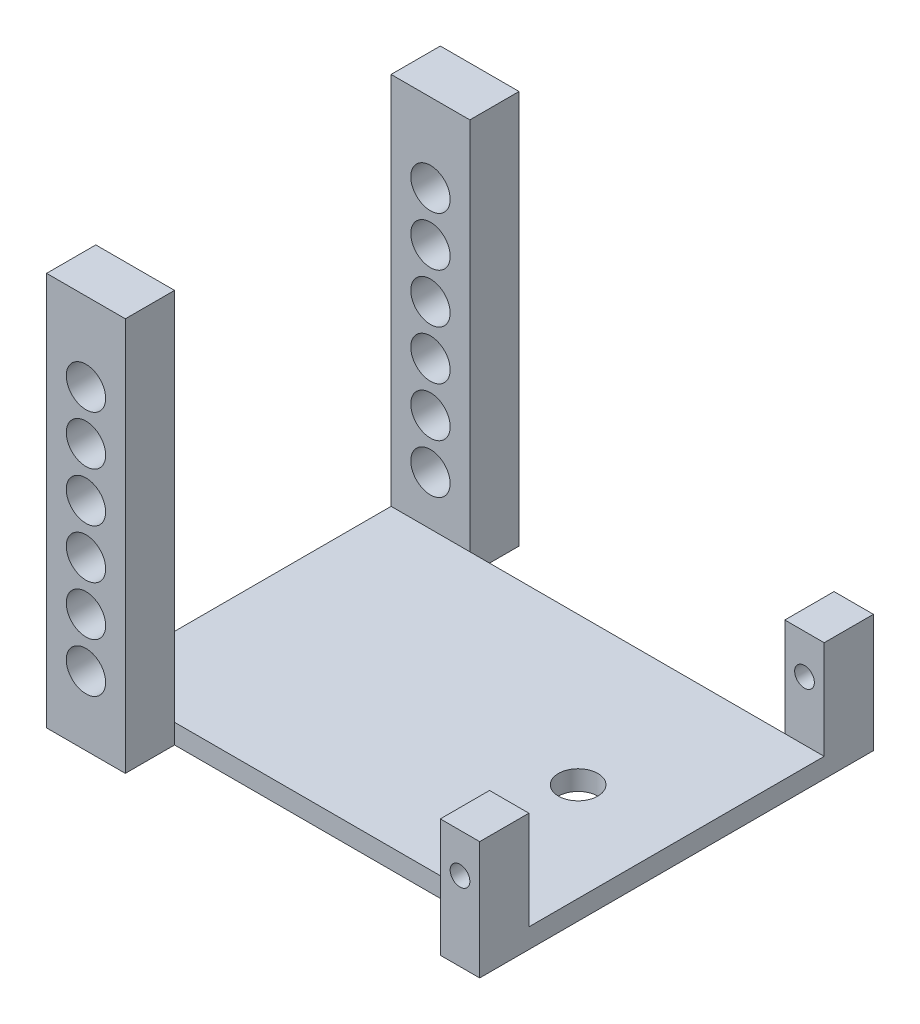
from build123d import *

# Parameters (mm, degrees)
SKETCH1_W           = 200
SKETCH1_H           = 150
BOSS_EXTRUDE1_DEPTH = 10
SKETCH2_R           = 10
CUT_EXTRUDE1_DEPTH  = 10
SKETCH4_W           = 150
SKETCH4_H           = 10
BOSS_EXTRUDE2_DEPTH = 20
SKETCH3_W           = 20
SKETCH3_H           = 60
BOSS_EXTRUDE3_DEPTH = 25
SKETCH5_W           = 20
SKETCH5_H           = 60
SKETCH5_W_2         = 40
SKETCH5_H_2         = 200
BOSS_EXTRUDE4_DEPTH = 25
SKETCH7_R           = 5
CUT_EXTRUDE3_DEPTH  = 251
SKETCH9_R           = 10
CUT_EXTRUDE4_DEPTH  = 241


with BuildPart() as part:
    # Sketch1 → Boss-Extrude1 (new body)
    with BuildSketch(Plane(origin=(0, 0, 0), x_dir=(1, 0, 0), z_dir=(0, 1, 0))):
        Rectangle(SKETCH1_W, SKETCH1_H)
    extrude(amount=BOSS_EXTRUDE1_DEPTH)

    # Sketch2 → Cut-Extrude1 (cut)
    with BuildSketch(Plane(origin=(0, 10, 0), x_dir=(1, 0, 0), z_dir=(0, 1, 0))):
        with Locations(Location((50, 0, 0), (0, 0, 270))):
            Circle(SKETCH2_R)
    extrude(amount=-CUT_EXTRUDE1_DEPTH, mode=Mode.SUBTRACT)

    # Sketch4 → Boss-Extrude2 (add)
    with BuildSketch(Plane.ZY.offset(100)):
        with Locations((0, 5)):
            Rectangle(SKETCH4_W, SKETCH4_H)
    extrude(amount=BOSS_EXTRUDE2_DEPTH)

    # Sketch3 → Boss-Extrude3 (add)
    with BuildSketch(Plane.XY.offset(75)):
        with Locations((90, 30)):
            Rectangle(SKETCH3_W, SKETCH3_H)
        Polygon((-100, 200), (-120, 200), (-120, 0), (-100, 0), (-80, 0), (-80, 200), align=None)
    extrude(amount=BOSS_EXTRUDE3_DEPTH)

    # Sketch5 → Boss-Extrude4 (add)
    with BuildSketch(Plane(origin=(0, 0, -75), x_dir=(-1, 0, 0), z_dir=(0, 0, -1))):
        with Locations((-90, 30)):
            Rectangle(SKETCH5_W, SKETCH5_H)
        with Locations((100, 100)):
            Rectangle(SKETCH5_W_2, SKETCH5_H_2)
    extrude(amount=BOSS_EXTRUDE4_DEPTH)

    # Sketch7 → Cut-Extrude3 (cut)
    with BuildSketch(Plane(origin=(0, 0, -100), x_dir=(-1, 0, 0), z_dir=(0, 0, -1))):
        with Locations((-90, 40)):
            Circle(SKETCH7_R)
    extrude(amount=-CUT_EXTRUDE3_DEPTH, mode=Mode.SUBTRACT)

    # Sketch9 → Cut-Extrude4 (cut)
    with BuildSketch(Plane.XY.offset(100)):
        with Locations((-100, 160)):
            Circle(SKETCH9_R)
        with Locations((-100, 135)):
            Circle(SKETCH9_R)
        with Locations((-100, 110)):
            Circle(SKETCH9_R)
        with Locations((-100, 85)):
            Circle(SKETCH9_R)
        with Locations((-100, 35)):
            Circle(SKETCH9_R)
        with Locations((-100, 60)):
            Circle(SKETCH9_R)
    extrude(amount=-CUT_EXTRUDE4_DEPTH, mode=Mode.SUBTRACT)


solid = part.part
